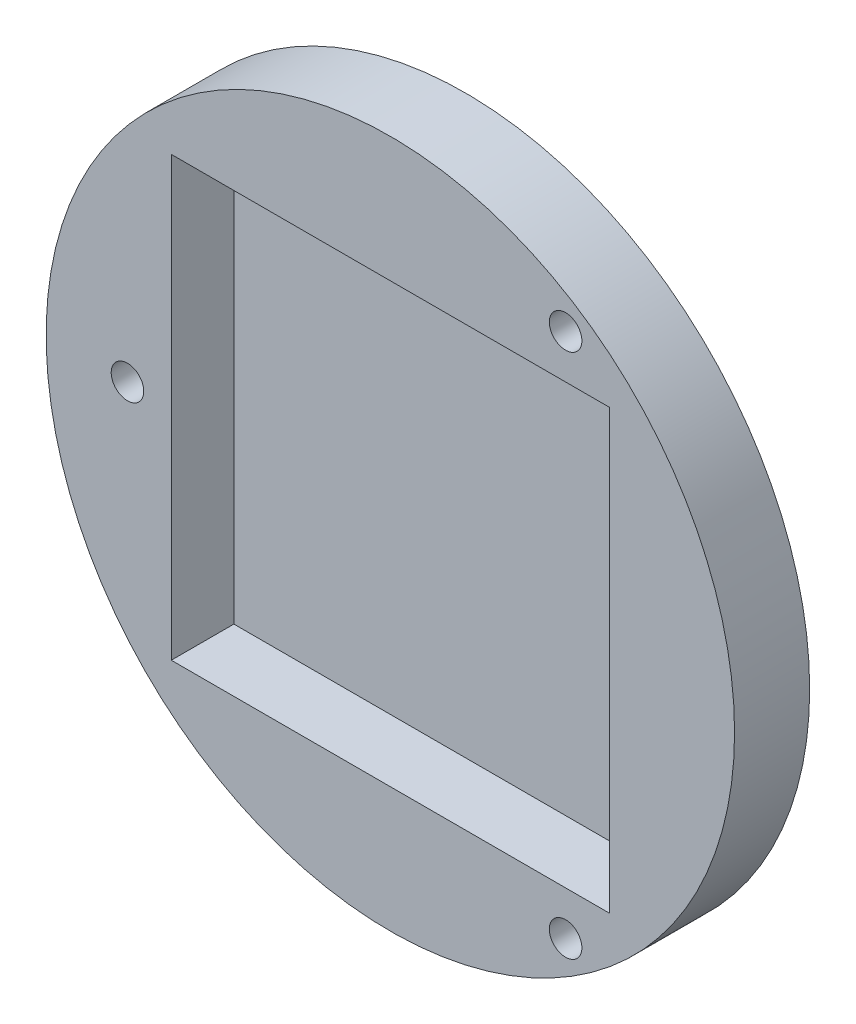
from build123d import *

# Parameters (mm, degrees)
SKETCH1_R            = 27.5
SKETCH1_W            = 35
SKETCH1_H            = 35
BOSS_EXTRUDE1_DEPTH  = 6
SKETCH1_3_W          = 35
SKETCH1_3_H          = 35
BOSS_EXTRUDE2_DEPTH  = 1
M2_CLEARANCE_HOLE1_D = 2.6


with BuildPart() as part:
    # Sketch1 → Boss-Extrude1 (new body)
    with BuildSketch(Plane.XY):
        Circle(SKETCH1_R)
        Rectangle(SKETCH1_W, SKETCH1_H, mode=Mode.SUBTRACT)
    extrude(amount=BOSS_EXTRUDE1_DEPTH)

    # Sketch1<3> → Boss-Extrude2 (add)
    with BuildSketch(Plane.XY):
        Rectangle(SKETCH1_3_W, SKETCH1_3_H)
    extrude(amount=BOSS_EXTRUDE2_DEPTH)

    # Sketch2 → Revolve1 (revolve)
    with BuildSketch(Plane(origin=(0, 0, 0), x_dir=(1, 0, 0), z_dir=(0, 1, 0))):
        with BuildLine():
            Line((0, 6.5), (0, 0))
            Line((0, 0), (-6.5, 0))
            ThreePointArc((-6.5, 0), (-4.596194078, 4.596194078), (0, 6.5))
        make_face()
    revolve(axis=Axis((0, 0, -15), (0, 0, 1)))

    # M2 Clearance Hole1 (through all)
    with Locations(Plane.XY.offset(6)):
        with Locations((-21, 0), (14, -21), (14, 21)):
            Hole(M2_CLEARANCE_HOLE1_D / 2)


solid = part.part
